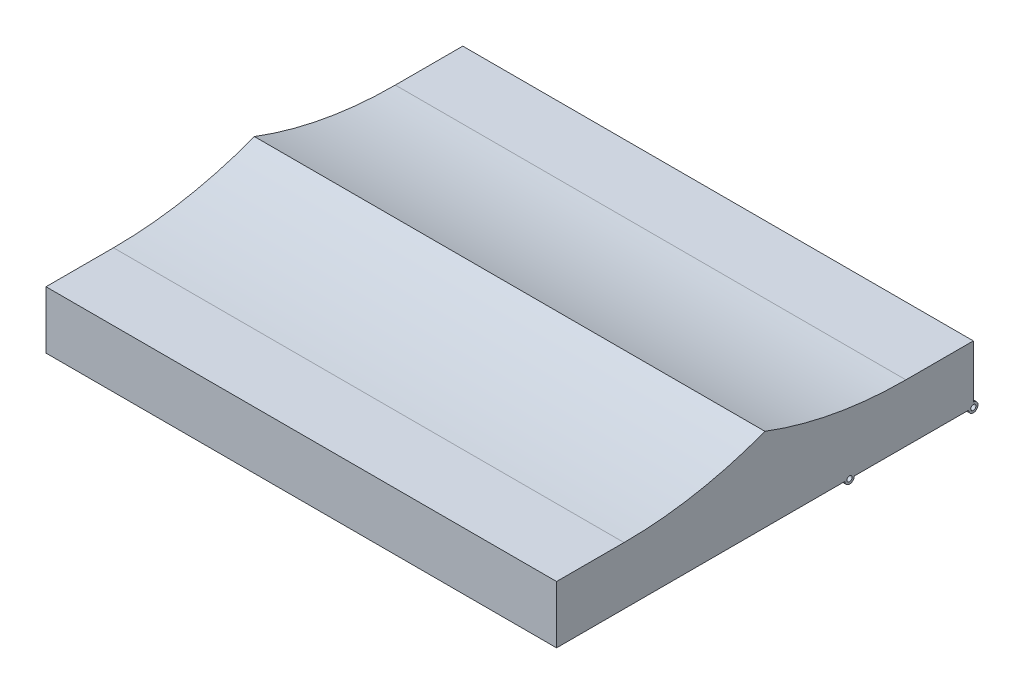
from build123d import *

# Parameters (mm, degrees)
ESBO_O1_R                = 2.5
RESSALTO_EXTRUS_O1_DEPTH = 245


with BuildPart() as part:
    # Esboço1 → Ressalto-extrusão1 (new, symmetric)
    with BuildSketch(Plane(origin=(0, 0, 0), x_dir=(0, 0, -1), z_dir=(1, 0, 0))):
        with BuildLine():
            Line((-200, -19.346040211), (-200, 35.835787631))
            Line((-200, 35.835787631), (-135.24, 35.835787631))
            ThreePointArc((-135.24, 35.835787631), (-66.489751819, 42.094735918), (0, 60.665787631))
            ThreePointArc((0, 60.665787631), (66.489751819, 42.094735918), (135.24, 35.835787631))
            Line((135.24, 35.835787631), (200, 35.835787631))
            Line((200, 35.835787631), (200, -15.024212369))
            ThreePointArc((200, -15.024212369), (203.164975379, -22.665138853), (195.524048894, -19.500163474))
            Line((195.524048894, -19.500163474), (186.500073192, -19.500163474))
            Line((186.500073192, -19.500163474), (85.729991436, -19.354819463))
            ThreePointArc((85.729991436, -19.354819463), (81.225610372, -23.84603807), (76.73, -19.346040211))
            Line((76.73, -19.346040211), (-200, -19.346040211))
        make_face()
        with Locations((81.23, -19.346040211)):
            Circle(ESBO_O1_R, mode=Mode.SUBTRACT)
        with Locations((200, -19.500163474)):
            Circle(ESBO_O1_R, mode=Mode.SUBTRACT)
    extrude(amount=RESSALTO_EXTRUS_O1_DEPTH, both=True)


solid = part.part
